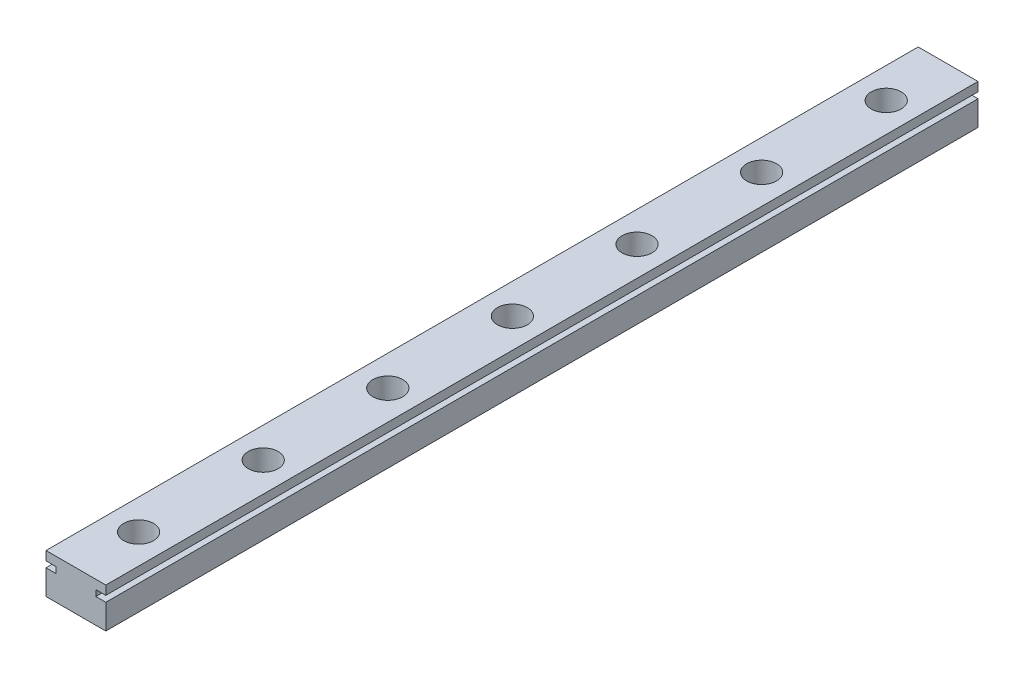
from build123d import *

# Parameters (mm, degrees)
BOSS_EXTRU_1_DEPTH      = 175
ESQUISSE2_R             = 3
ENL_V_MAT_EXTRU_1_DEPTH = 4.5
ENL_V_MAT_EXTRU_2_REACH = 177.327
ESQUISSE3_R             = 1.75


with BuildPart() as part:
    # Esquisse1 → Boss.-Extru.1 (new body)
    with BuildSketch(Plane.XY):
        Polygon((-2.287966089, -3.148854962), (9.712033911, -3.148854962), (9.712033911, 1.851145038), (7.712033911, 1.851145038), (7.712033911, 3.051145038), (9.712033911, 3.051145038), (9.712033911, 4.851145038), (-2.287966089, 4.851145038), (-2.287966089, 3.051145038), (-0.287966089, 3.051145038), (-0.287966089, 1.851145038), (-2.287966089, 1.851145038), align=None)
    extrude(amount=BOSS_EXTRU_1_DEPTH)

    # Esquisse2 → Enlèv. mat.-Extru.1 (cut)
    with BuildSketch(Plane(origin=(0, 4.851145038, 0), x_dir=(1, 0, 0), z_dir=(0, 1, 0))):
        with Locations(Location((3.792841972, -162.5, 0), (0, 0, 180))):
            Circle(ESQUISSE2_R)
        with Locations(Location((3.792841972, -137.5, 0), (0, 0, 180))):
            Circle(ESQUISSE2_R)
        with Locations(Location((3.792841972, -112.5, 0), (0, 0, 180))):
            Circle(ESQUISSE2_R)
        with Locations(Location((3.792841972, -87.5, 0), (0, 0, 180))):
            Circle(ESQUISSE2_R)
        with Locations(Location((3.792841972, -62.5, 0), (0, 0, 180))):
            Circle(ESQUISSE2_R)
        with Locations(Location((3.792841972, -37.5, 0), (0, 0, 180))):
            Circle(ESQUISSE2_R)
        with Locations(Location((3.792841972, -12.5, 0), (0, 0, 180))):
            Circle(ESQUISSE2_R)
    extrude(amount=-ENL_V_MAT_EXTRU_1_DEPTH, mode=Mode.SUBTRACT)

    # Esquisse3 → Enlèv. mat.-Extru.2 (cut, up to next)
    with BuildSketch(Plane(origin=(0, 0.351145038, 0), x_dir=(1, 0, 0), z_dir=(0, 1, 0)), mode=Mode.PRIVATE) as enl_v_mat_extru_2_sk1:
        with Locations(Location((3.792841972, -162.5, 0), (0, 0, 180))):
            Circle(ESQUISSE3_R)
    enl_v_mat_extru_2_tool1 = extrude(enl_v_mat_extru_2_sk1.sketch, amount=-ENL_V_MAT_EXTRU_2_REACH, mode=Mode.PRIVATE) & part.part
    # Esquisse3 → Enlèv. mat.-Extru.2 (cut, up to next)
    with BuildSketch(Plane(origin=(0, 0.351145038, 0), x_dir=(1, 0, 0), z_dir=(0, 1, 0)), mode=Mode.PRIVATE) as enl_v_mat_extru_2_sk2:
        with Locations(Location((3.792841972, -137.5, 0), (0, 0, 180))):
            Circle(ESQUISSE3_R)
    enl_v_mat_extru_2_tool2 = extrude(enl_v_mat_extru_2_sk2.sketch, amount=-ENL_V_MAT_EXTRU_2_REACH, mode=Mode.PRIVATE) & part.part
    # Esquisse3 → Enlèv. mat.-Extru.2 (cut, up to next)
    with BuildSketch(Plane(origin=(0, 0.351145038, 0), x_dir=(1, 0, 0), z_dir=(0, 1, 0)), mode=Mode.PRIVATE) as enl_v_mat_extru_2_sk3:
        with Locations(Location((3.792841972, -112.5, 0), (0, 0, 180))):
            Circle(ESQUISSE3_R)
    enl_v_mat_extru_2_tool3 = extrude(enl_v_mat_extru_2_sk3.sketch, amount=-ENL_V_MAT_EXTRU_2_REACH, mode=Mode.PRIVATE) & part.part
    # Esquisse3 → Enlèv. mat.-Extru.2 (cut, up to next)
    with BuildSketch(Plane(origin=(0, 0.351145038, 0), x_dir=(1, 0, 0), z_dir=(0, 1, 0)), mode=Mode.PRIVATE) as enl_v_mat_extru_2_sk4:
        with Locations(Location((3.792841972, -87.5, 0), (0, 0, 180))):
            Circle(ESQUISSE3_R)
    enl_v_mat_extru_2_tool4 = extrude(enl_v_mat_extru_2_sk4.sketch, amount=-ENL_V_MAT_EXTRU_2_REACH, mode=Mode.PRIVATE) & part.part
    # Esquisse3 → Enlèv. mat.-Extru.2 (cut, up to next)
    with BuildSketch(Plane(origin=(0, 0.351145038, 0), x_dir=(1, 0, 0), z_dir=(0, 1, 0)), mode=Mode.PRIVATE) as enl_v_mat_extru_2_sk5:
        with Locations(Location((3.792841972, -62.5, 0), (0, 0, 180))):
            Circle(ESQUISSE3_R)
    enl_v_mat_extru_2_tool5 = extrude(enl_v_mat_extru_2_sk5.sketch, amount=-ENL_V_MAT_EXTRU_2_REACH, mode=Mode.PRIVATE) & part.part
    # Esquisse3 → Enlèv. mat.-Extru.2 (cut, up to next)
    with BuildSketch(Plane(origin=(0, 0.351145038, 0), x_dir=(1, 0, 0), z_dir=(0, 1, 0)), mode=Mode.PRIVATE) as enl_v_mat_extru_2_sk6:
        with Locations(Location((3.792841972, -37.5, 0), (0, 0, 180))):
            Circle(ESQUISSE3_R)
    enl_v_mat_extru_2_tool6 = extrude(enl_v_mat_extru_2_sk6.sketch, amount=-ENL_V_MAT_EXTRU_2_REACH, mode=Mode.PRIVATE) & part.part
    # Esquisse3 → Enlèv. mat.-Extru.2 (cut, up to next)
    with BuildSketch(Plane(origin=(0, 0.351145038, 0), x_dir=(1, 0, 0), z_dir=(0, 1, 0)), mode=Mode.PRIVATE) as enl_v_mat_extru_2_sk7:
        with Locations(Location((3.792841972, -12.5, 0), (0, 0, 180))):
            Circle(ESQUISSE3_R)
    enl_v_mat_extru_2_tool7 = extrude(enl_v_mat_extru_2_sk7.sketch, amount=-ENL_V_MAT_EXTRU_2_REACH, mode=Mode.PRIVATE) & part.part
    add(enl_v_mat_extru_2_tool1.solids().sort_by_distance((3.792842, 0.351145, 162.5))[0], mode=Mode.SUBTRACT)
    add(enl_v_mat_extru_2_tool2.solids().sort_by_distance((3.792842, 0.351145, 137.5))[0], mode=Mode.SUBTRACT)
    add(enl_v_mat_extru_2_tool3.solids().sort_by_distance((3.792842, 0.351145, 112.5))[0], mode=Mode.SUBTRACT)
    add(enl_v_mat_extru_2_tool4.solids().sort_by_distance((3.792842, 0.351145, 87.5))[0], mode=Mode.SUBTRACT)
    add(enl_v_mat_extru_2_tool5.solids().sort_by_distance((3.792842, 0.351145, 62.5))[0], mode=Mode.SUBTRACT)
    add(enl_v_mat_extru_2_tool6.solids().sort_by_distance((3.792842, 0.351145, 37.5))[0], mode=Mode.SUBTRACT)
    add(enl_v_mat_extru_2_tool7.solids().sort_by_distance((3.792842, 0.351145, 12.5))[0], mode=Mode.SUBTRACT)


solid = part.part
